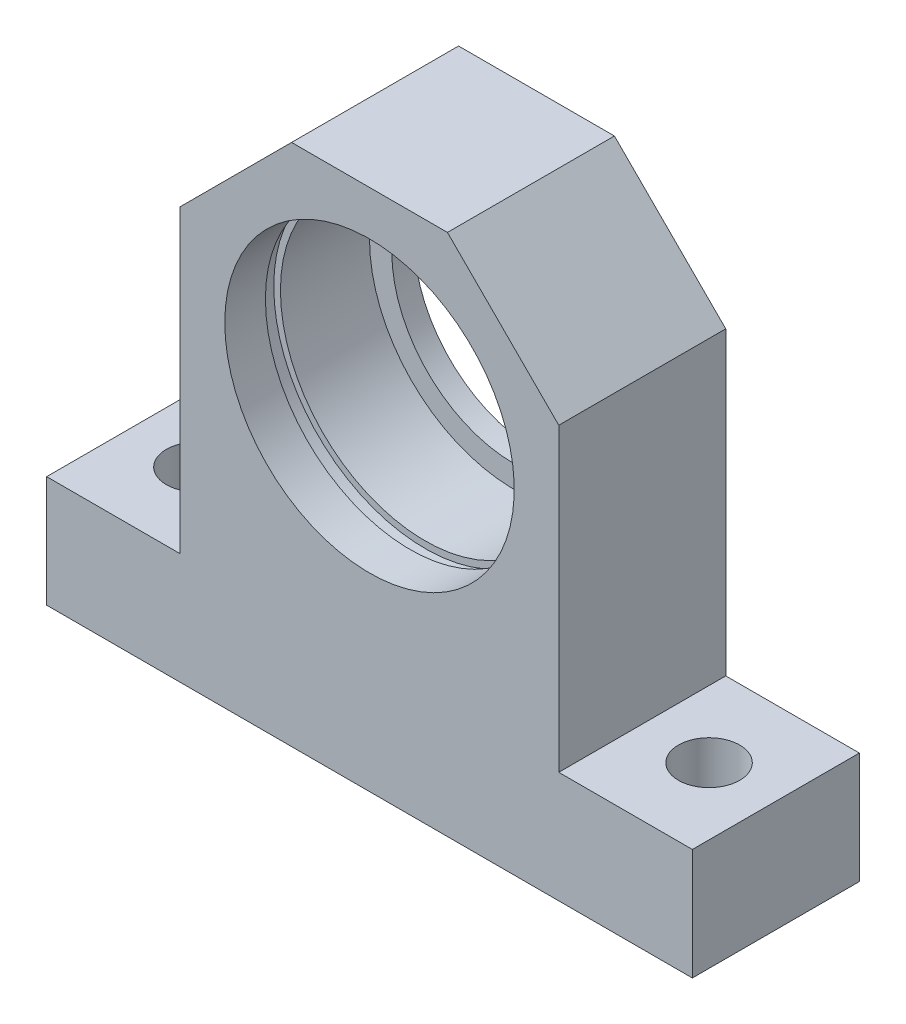
from build123d import *

# Parameters (mm, degrees)
BOSS_EXTRUDE1_DEPTH = 15
DIAMETER_HOLE1_D    = 5.5
CHAMFER1_SIZE       = 10


with BuildPart() as part:
    # Sketch1 → Boss-Extrude1 (new body)
    with BuildSketch(Plane.XY):
        Polygon((-17, 47), (17, 47), (17, 10), (29, 10), (29, 0), (-29, 0), (-29, 10), (-17, 10), align=None)
    extrude(amount=-BOSS_EXTRUDE1_DEPTH)

    # Sketch2 → Cut-Revolve1 (revolve, cut)
    with BuildSketch(Plane(origin=(0, 0, 0), x_dir=(0, 0, -1), z_dir=(1, 0, 0))):
        Polygon((3.65, 43), (3.65, 43.6), (5, 43.6), (5, 43), (13, 43), (13, 41), (15, 41), (15, 30), (0, 30), (0, 43), align=None)
    revolve(axis=Axis((0, 30, -15), (0, 0, 1)), mode=Mode.SUBTRACT)

    # Diameter Hole1 (through all)
    with Locations(Plane(origin=(0, 10, 0), x_dir=(1, 0, 0), z_dir=(0, 1, 0))):
        with Locations((-23, 7.5), (23, 7.5)):
            Hole(DIAMETER_HOLE1_D / 2)

    # Chamfer1
    chamfer1_edges = [part.edges().sort_by_distance(p)[0] for p in [
        (-17, 47, -7.5),
        (17, 47, -7.5),
    ]]
    chamfer(chamfer1_edges, length=CHAMFER1_SIZE)


solid = part.part
